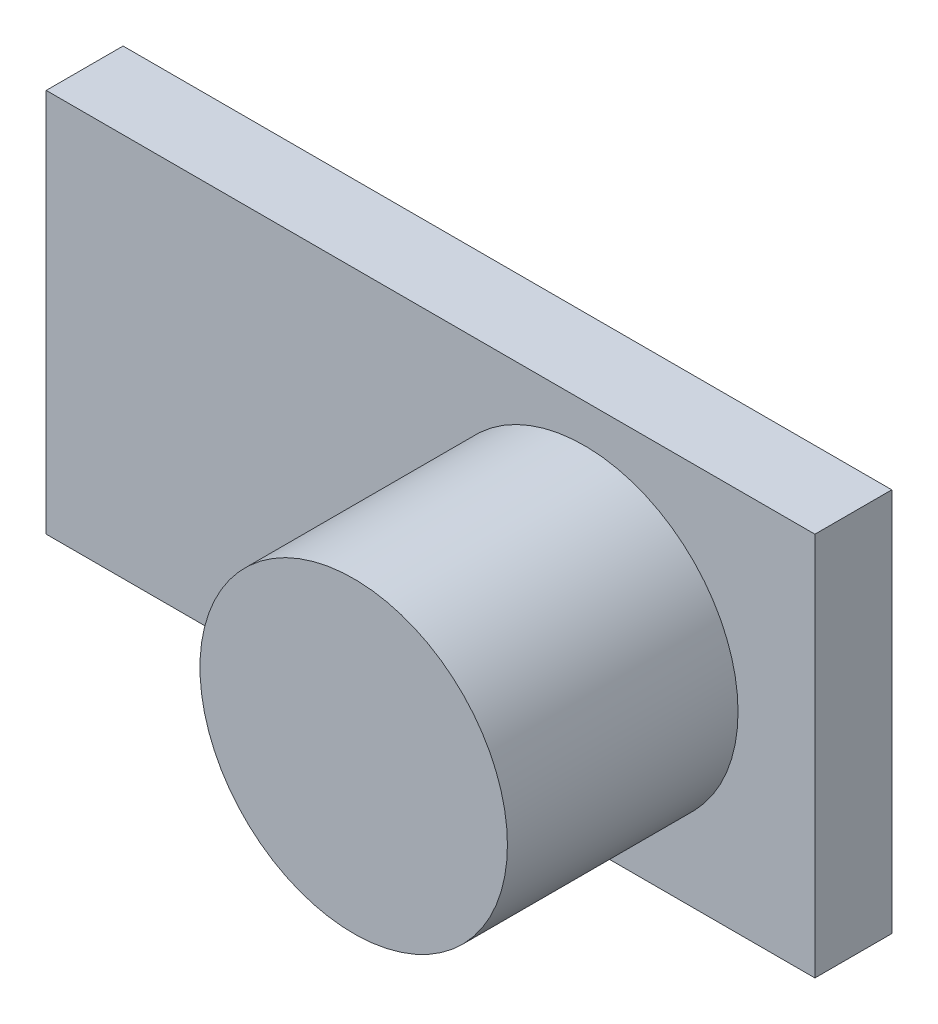
from build123d import *

# Parameters (mm, degrees)
SKETCH1_W           = 20
SKETCH1_H           = 10
BOSS_EXTRUDE1_DEPTH = 2
SKETCH2_R           = 4
BOSS_EXTRUDE2_DEPTH = 6


with BuildPart() as part:
    # Sketch1 → Boss-Extrude1 (new body)
    with BuildSketch(Plane.XY):
        with Locations((0, -27.096458497)):
            Rectangle(SKETCH1_W, SKETCH1_H)
    extrude(amount=BOSS_EXTRUDE1_DEPTH)

    # Sketch2 → Boss-Extrude2 (add)
    with BuildSketch(Plane.XY.offset(2)):
        with Locations((4, -27.096458497)):
            Circle(SKETCH2_R)
    extrude(amount=BOSS_EXTRUDE2_DEPTH)


solid = part.part
